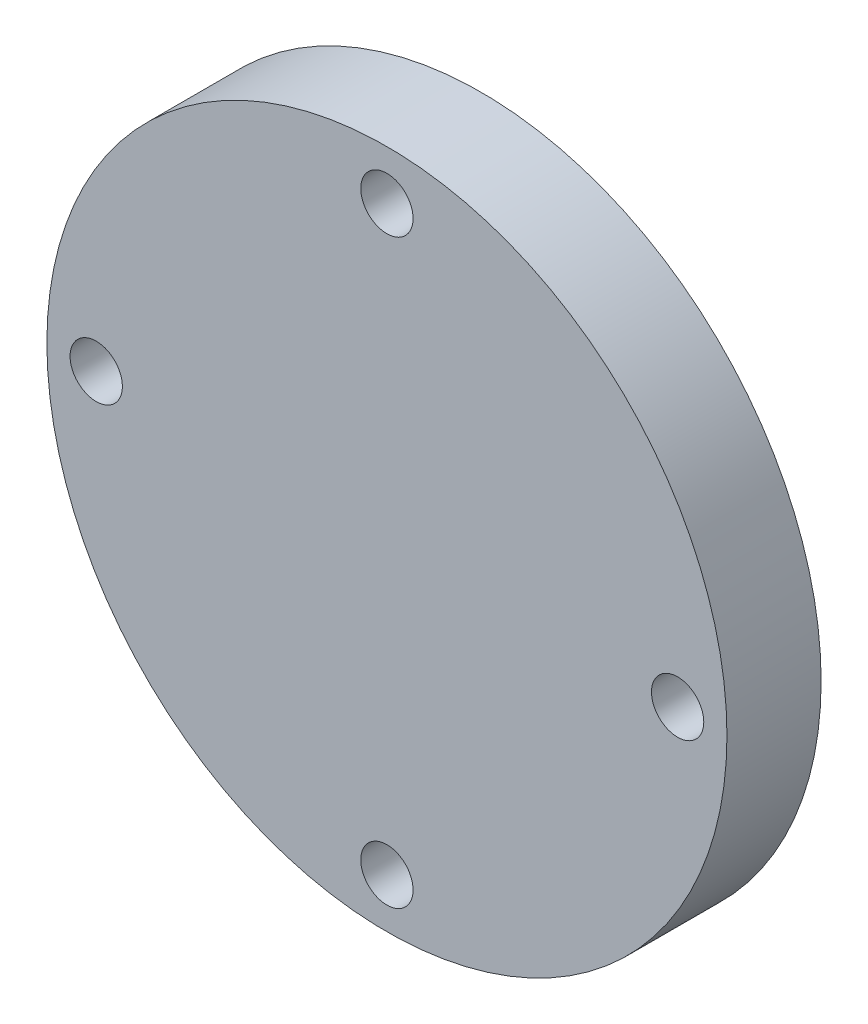
from build123d import *

# Parameters (mm, degrees)
BOSS_EXTRUDE1_START = 1
SKETCH1_R           = 32.5
SKETCH1_R_2         = 21
BOSS_EXTRUDE1_DEPTH = 1
SKETCH2_R           = 32.5
BOSS_EXTRUDE2_DEPTH = 8
SKETCH3_R           = 2.5
CUT_EXTRUDE1_DEPTH  = 47.834816109


with BuildPart() as part:
    # Sketch1 → Boss-Extrude1 (new body)
    with BuildSketch(Plane.XY.offset(BOSS_EXTRUDE1_START)):
        Circle(SKETCH1_R)
        Circle(SKETCH1_R_2, mode=Mode.SUBTRACT)
    extrude(amount=BOSS_EXTRUDE1_DEPTH)

    # Sketch2 → Boss-Extrude2 (add)
    with BuildSketch(Plane.XY.offset(2)):
        Circle(SKETCH2_R)
    extrude(amount=BOSS_EXTRUDE2_DEPTH)

    # Sketch3 → Cut-Extrude1 (cut, through all)
    with BuildSketch(Plane.XY.offset(10)):
        with Locations((0, 27.783091373)):
            Circle(SKETCH3_R)
        with Locations((27.783091373, 0)):
            Circle(SKETCH3_R)
        with Locations((0, -27.783091373)):
            Circle(SKETCH3_R)
        with Locations((-27.783091373, 0)):
            Circle(SKETCH3_R)
    extrude(amount=-CUT_EXTRUDE1_DEPTH, mode=Mode.SUBTRACT)


solid = part.part
